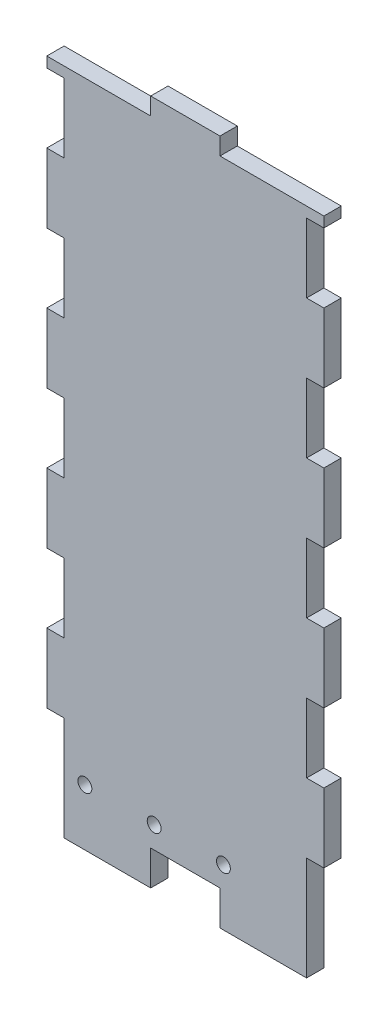
from build123d import *

# Parameters (mm, degrees)
SKETCH_1_W                      = 80
SKETCH_1_H                      = 183
EXTRUDE_1_DEPTH                 = 5
CUT_EXTRUDE_1_REACH             = 101.986
SKETCH_2_W                      = 5
SKETCH_2_H                      = 20
CUT_EXTRUDE_1_DIRECTION_2_DEPTH = 100.986249055
PATTERN_LINEAR_1_COUNT          = 5
PATTERN_LINEAR_1_PITCH          = 40
CUT_EXTRUDE_3_REACH             = 101.986
SKETCH_4_W                      = 5
SKETCH_4_H                      = 20
PATTERN_LINEAR_4_COUNT          = 5
PATTERN_LINEAR_4_PITCH          = 40
SKETCH_5_W                      = 20
SKETCH_5_H                      = 5
EXTRUDE_2_DEPTH                 = 5
SKETCH_6_W                      = 25
SKETCH_6_H                      = 10
EXTRUDE_3_DEPTH                 = 5
CUT_EXTRUDE_4_REACH             = 111.212
SKETCH_7_R                      = 2
PATTERN_LINEAR_5_COUNT          = 2
PATTERN_LINEAR_5_PITCH          = 40
PATTERN_LINEAR_6_COUNT          = 2
PATTERN_LINEAR_6_PITCH          = 20


with BuildPart() as part:
    # 스케치1 → 보스-돌출1 (new body)
    with BuildSketch(Plane.XY):
        Rectangle(SKETCH_1_W, SKETCH_1_H)
    extrude(amount=EXTRUDE_1_DEPTH)

    # 스케치2 → 컷-돌출1 (cut, up to next)
    with BuildSketch(Plane.XY.offset(5), mode=Mode.PRIVATE) as cut_extrude_1_sk1:
        with Locations((-37.5, -81.5)):
            Rectangle(SKETCH_2_W, SKETCH_2_H)
    cut_extrude_1_tool1 = extrude(cut_extrude_1_sk1.sketch, amount=-CUT_EXTRUDE_1_REACH, mode=Mode.PRIVATE) & part.part
    cut_extrude_1 = cut_extrude_1_tool1.solids().sort_by_distance((-37.5, -81.5, 5))[0]
    add(cut_extrude_1, mode=Mode.SUBTRACT)

    # 스케치2 → 컷-돌출1 direction 2 (cut)
    with BuildSketch(Plane.XY.offset(5)):
        with Locations((-37.5, -81.5)):
            Rectangle(SKETCH_2_W, SKETCH_2_H)
    cut_extrude_1_direction_2 = extrude(amount=CUT_EXTRUDE_1_DIRECTION_2_DEPTH, mode=Mode.SUBTRACT)

    # 선형 패턴1: 컷-돌출1, 컷-돌출1 direction 2 ×5
    with Locations(*[(0, i * PATTERN_LINEAR_1_PITCH, 0) for i in range(1, PATTERN_LINEAR_1_COUNT)]):
        add(cut_extrude_1, mode=Mode.SUBTRACT)
        add(cut_extrude_1_direction_2, mode=Mode.SUBTRACT)

    # 스케치4 → 컷-돌출3 (cut, up to next)
    with BuildSketch(Plane.XY.offset(5), mode=Mode.PRIVATE) as cut_extrude_3_sk1:
        with Locations((37.5, -81.5)):
            Rectangle(SKETCH_4_W, SKETCH_4_H)
    cut_extrude_3_tool1 = extrude(cut_extrude_3_sk1.sketch, amount=-CUT_EXTRUDE_3_REACH, mode=Mode.PRIVATE) & part.part
    cut_extrude_3 = cut_extrude_3_tool1.solids().sort_by_distance((37.5, -81.5, 5))[0]
    add(cut_extrude_3, mode=Mode.SUBTRACT)

    # 선형 패턴4: 컷-돌출3 ×5
    with Locations(*[(0, i * PATTERN_LINEAR_4_PITCH, 0) for i in range(1, PATTERN_LINEAR_4_COUNT)]):
        add(cut_extrude_3, mode=Mode.SUBTRACT)

    # 스케치5 → 보스-돌출2 (add)
    with BuildSketch(Plane.XY.offset(5)):
        with Locations((0, 94)):
            Rectangle(SKETCH_5_W, SKETCH_5_H)
    extrude(amount=-EXTRUDE_2_DEPTH)

    # 스케치6 → 보스-돌출3 (add)
    with BuildSketch(Plane.XY.offset(5)):
        with Locations((-22.5, -96.5)):
            Rectangle(SKETCH_6_W, SKETCH_6_H)
        with Locations((22.5, -96.5)):
            Rectangle(SKETCH_6_W, SKETCH_6_H)
    extrude(amount=-EXTRUDE_3_DEPTH)

    # 스케치7 → 컷-돌출4 (cut, up to next)
    with BuildSketch(Plane.XY.offset(5), mode=Mode.PRIVATE) as cut_extrude_4_sk1:
        with Locations((-29, -85.2)):
            Circle(SKETCH_7_R)
    cut_extrude_4_tool1 = extrude(cut_extrude_4_sk1.sketch, amount=-CUT_EXTRUDE_4_REACH, mode=Mode.PRIVATE) & part.part
    cut_extrude_4 = cut_extrude_4_tool1.solids().sort_by_distance((-29, -85.2, 5))[0]
    add(cut_extrude_4, mode=Mode.SUBTRACT)

    # 선형 패턴5: 컷-돌출4 ×2
    with Locations(*[(i * PATTERN_LINEAR_5_PITCH, 0, 0) for i in range(1, PATTERN_LINEAR_5_COUNT)]):
        add(cut_extrude_4, mode=Mode.SUBTRACT)

    # 선형 패턴6: 컷-돌출4 ×2
    with Locations(*[(i * PATTERN_LINEAR_6_PITCH, 0, 0) for i in range(1, PATTERN_LINEAR_6_COUNT)]):
        add(cut_extrude_4, mode=Mode.SUBTRACT)


solid = part.part
